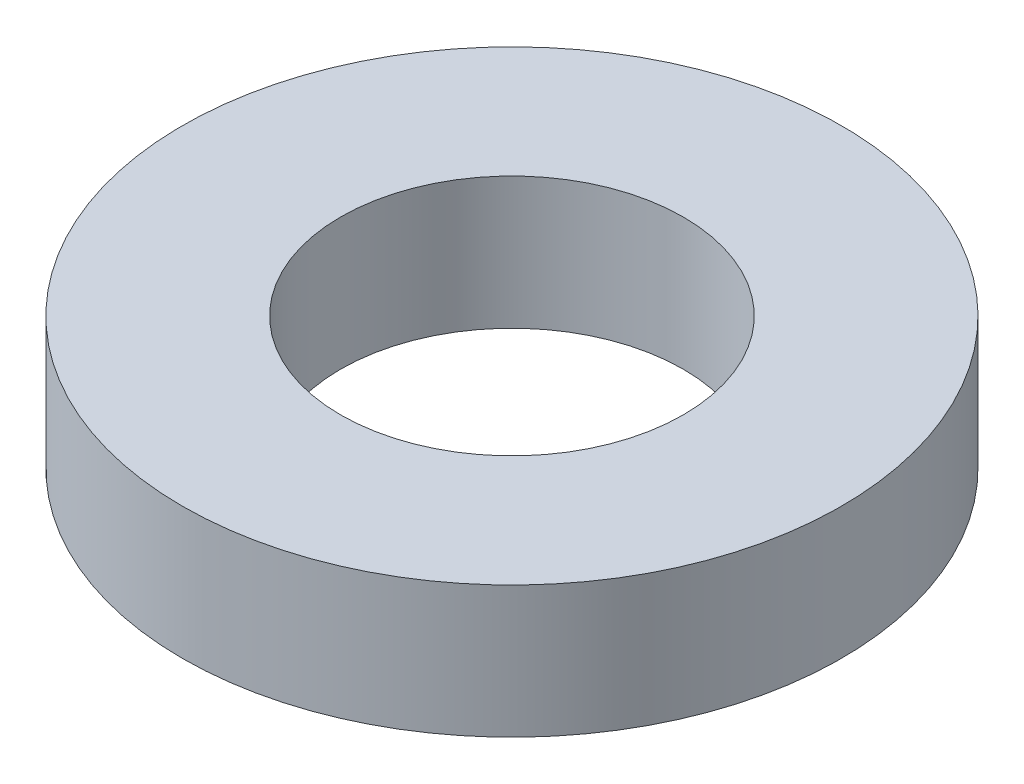
from build123d import *

# Parameters (mm, degrees)
SKETCH1_R           = 3.125
SKETCH1_R_2         = 1.625
BOSS_EXTRUDE1_DEPTH = 1.25


with BuildPart() as part:
    # Sketch1 → Boss-Extrude1 (new body)
    with BuildSketch(Plane(origin=(0, 0, 0), x_dir=(1, 0, 0), z_dir=(0, 1, 0))):
        with Locations(Location((0, 0, 0), (0, 0, 270))):
            Circle(SKETCH1_R)
        with Locations(Location((0, 0, 0), (0, 0, 270))):
            Circle(SKETCH1_R_2, mode=Mode.SUBTRACT)
    extrude(amount=BOSS_EXTRUDE1_DEPTH)


solid = part.part
